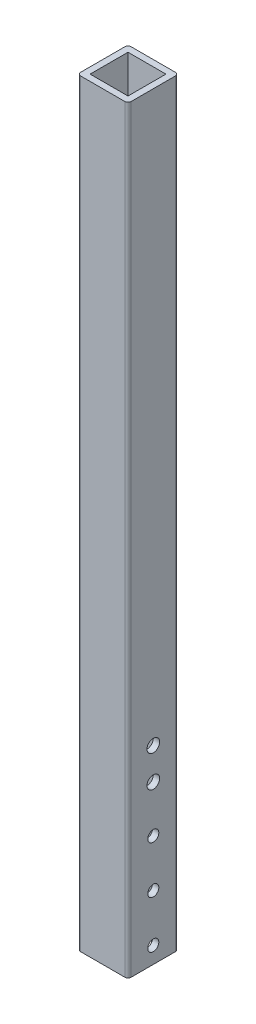
from build123d import *

# Parameters (mm, degrees)
SKETCH1_W           = 16
SKETCH1_H           = 16
SKETCH1_W_2         = 12
SKETCH1_H_2         = 12
BOSS_EXTRUDE1_DEPTH = 240
FILLET1_R           = 1
SKETCH2_R           = 1.75
CUT_EXTRUDE1_DEPTH  = 20
SKETCH3_R           = 2
CUT_EXTRUDE2_DEPTH  = 20


with BuildPart() as part:
    # Sketch1 → Boss-Extrude1 (new body)
    with BuildSketch(Plane(origin=(0, 0, 0), x_dir=(1, 0, 0), z_dir=(0, 1, 0))):
        with Locations((2.245614035, -1.684210526)):
            Rectangle(SKETCH1_W, SKETCH1_H)
        with Locations((2.245614035, -1.684210526)):
            Rectangle(SKETCH1_W_2, SKETCH1_H_2, mode=Mode.SUBTRACT)
    extrude(amount=BOSS_EXTRUDE1_DEPTH)

    # Fillet1
    fillet1_edges = [part.edges().sort_by_distance(p)[0] for p in [
        (-5.754385965, 120, -6.315789474),
        (10.245614035, 120, -6.315789474),
        (10.245614035, 120, 9.684210526),
        (-5.754385965, 120, 9.684210526),
    ]]
    fillet(fillet1_edges, radius=FILLET1_R)

    # Sketch2 → Cut-Extrude1 (cut)
    with BuildSketch(Plane(origin=(10.245614035, 0, 0), x_dir=(0, 0, -1), z_dir=(1, 0, 0))):
        with Locations((-1.684210526, 35.25)):
            Circle(SKETCH2_R)
        with Locations((-1.684210526, 5.25)):
            Circle(SKETCH2_R)
        with Locations((-1.684210526, 20.25)):
            Circle(SKETCH2_R)
    extrude(amount=-CUT_EXTRUDE1_DEPTH, mode=Mode.SUBTRACT)

    # Sketch3 → Cut-Extrude2 (cut)
    with BuildSketch(Plane(origin=(10.245614035, 0, 0), x_dir=(0, 0, -1), z_dir=(1, 0, 0))):
        with Locations((-1.684210526, 60)):
            Circle(SKETCH3_R)
        with Locations((-1.684210526, 50)):
            Circle(SKETCH3_R)
    extrude(amount=-CUT_EXTRUDE2_DEPTH, mode=Mode.SUBTRACT)


solid = part.part
